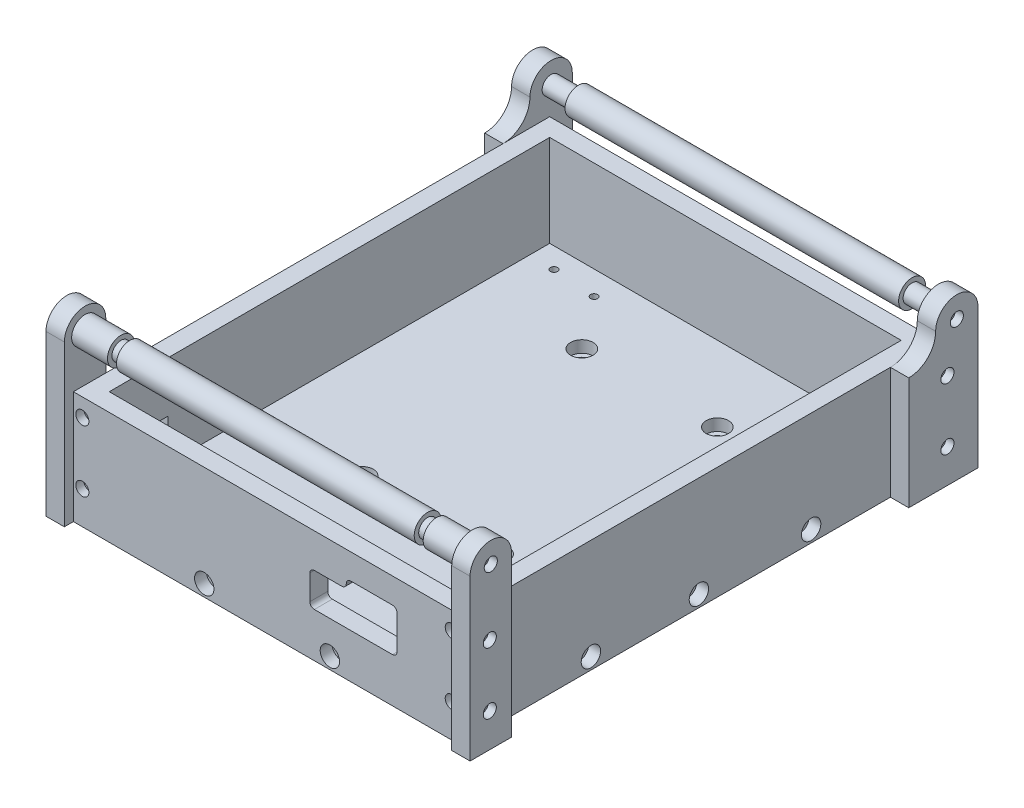
from build123d import *

# Parameters (mm, degrees)
SKETCH1_W                                           = 137.2
SKETCH1_H                                           = 168.7
BOSS_EXTRUDE1_DEPTH                                 = 6.35
BOSS_EXTRUDE2_DEPTH                                 = 32.5
BOSS_EXTRUDE2_DEPTH_BACK                            = 7.35
SKETCH3_W                                           = 137.2
SKETCH3_H                                           = 168.7
SKETCH3_W_2                                         = 124.5
SKETCH3_H_2                                         = 156
CBORE_FOR_0_SOCKET_HEAD_CAP_SCREW1_D                = 2.38125
CBORE_FOR_0_SOCKET_HEAD_CAP_SCREW1_DEPTH            = 10.05
CBORE_FOR_0_SOCKET_HEAD_CAP_SCREW1_CBORE_D          = 4.6482
CBORE_FOR_0_SOCKET_HEAD_CAP_SCREW1_CBORE_DEPTH      = 2.8448
CBORE_FOR_0_SOCKET_HEAD_CAP_SCREW1_TIP              = 0.715399675
CBORE_FOR_0_SOCKET_HEAD_CAP_SCREW2_D                = 3.571875
CBORE_FOR_0_SOCKET_HEAD_CAP_SCREW2_DEPTH            = 10.05
CBORE_FOR_0_SOCKET_HEAD_CAP_SCREW2_CBORE_D          = 6.858
CBORE_FOR_0_SOCKET_HEAD_CAP_SCREW2_CBORE_DEPTH      = 4.1656
CBORE_FOR_0_SOCKET_HEAD_CAP_SCREW2_TIP              = 1.073099512
CBORE_FOR_0_SOCKET_HEAD_CAP_SCREW2_ON_F_D           = 3.571875
CBORE_FOR_0_SOCKET_HEAD_CAP_SCREW2_ON_F_DEPTH       = 10.05
CBORE_FOR_0_SOCKET_HEAD_CAP_SCREW2_ON_F_CBORE_D     = 6.858
CBORE_FOR_0_SOCKET_HEAD_CAP_SCREW2_ON_F_CBORE_DEPTH = 4.1656
CBORE_FOR_0_SOCKET_HEAD_CAP_SCREW2_ON_F_TIP         = 1.073099512
BOSS_EXTRUDE3_DEPTH                                 = 6.497870199
SKETCH11_R                                          = 3.175
BOSS_EXTRUDE4_DEPTH                                 = 150.195740398
SKETCH13_R                                          = 3.175
BOSS_EXTRUDE5_DEPTH                                 = 150.195740398
BOSS_EXTRUDE6_START                                 = -15.85
SKETCH15_R                                          = 4.7625
BOSS_EXTRUDE6_DEPTH                                 = 118.15
CBORE_FOR_0_SOCKET_HEAD_CAP_SCREW3_D                = 2.38125
CBORE_FOR_0_SOCKET_HEAD_CAP_SCREW3_DEPTH            = 10.05
CBORE_FOR_0_SOCKET_HEAD_CAP_SCREW3_CBORE_D          = 4.6482
CBORE_FOR_0_SOCKET_HEAD_CAP_SCREW3_CBORE_DEPTH      = 2.8448
CBORE_FOR_0_SOCKET_HEAD_CAP_SCREW3_TIP              = 0.715399675
CBORE_FOR_8_SOCKET_HEAD_CAP_SCREW1_D                = 4.4958
CBORE_FOR_8_SOCKET_HEAD_CAP_SCREW1_DEPTH            = 10.05
CBORE_FOR_8_SOCKET_HEAD_CAP_SCREW1_CBORE_D          = 7.9375
CBORE_FOR_8_SOCKET_HEAD_CAP_SCREW1_CBORE_DEPTH      = 4.1656
CBORE_FOR_8_SOCKET_HEAD_CAP_SCREW1_TIP              = 1.350674586
CUT_EXTRUDE1_DEPTH                                  = 10
SKETCH24_R                                          = 4.7625
BOSS_EXTRUDE7_DEPTH                                 = 12.7
BOSS_EXTRUDE8_START                                 = 3.175
SKETCH25_R                                          = 4.7625
BOSS_EXTRUDE8_DEPTH                                 = 52.73
SKETCH27_R                                          = 1.25
CUT_EXTRUDE3_DEPTH                                  = 10
SKETCH28_W                                          = 15
SKETCH28_H                                          = 8
CUT_EXTRUDE4_DEPTH                                  = 10


with BuildPart() as part:
    # Sketch1 → Boss-Extrude1 (new body)
    with BuildSketch(Plane(origin=(0, 0, 0), x_dir=(1, 0, 0), z_dir=(0, 1, 0))):
        with Locations((57.25, 73)):
            Rectangle(SKETCH1_W, SKETCH1_H)
    extrude(amount=-BOSS_EXTRUDE1_DEPTH)

    # Sketch3 → Boss-Extrude2 (add, two sides: drawn at the far end of the back side and taken through both)
    with BuildSketch(Plane(origin=(0, 0, 0), x_dir=(1, 0, 0), z_dir=(0, 1, 0)).offset(-BOSS_EXTRUDE2_DEPTH_BACK)):
        with Locations((57.25, 73)):
            Rectangle(SKETCH3_W, SKETCH3_H)
        with Locations((57.25, 73)):
            Rectangle(SKETCH3_W_2, SKETCH3_H_2, mode=Mode.SUBTRACT)
    extrude(amount=BOSS_EXTRUDE2_DEPTH + BOSS_EXTRUDE2_DEPTH_BACK)

    # CBORE for #0 Socket Head Cap Screw1
    with Locations(Plane(origin=(-8.175, 26.15, 11.35), x_dir=(1, 0, 0), z_dir=(0, 0, 1))):
        with Locations((0, 0), (0, -21.825), (130.85, 0), (130.85, -21.825)):
            CounterBoreHole(CBORE_FOR_0_SOCKET_HEAD_CAP_SCREW1_D / 2, CBORE_FOR_0_SOCKET_HEAD_CAP_SCREW1_CBORE_D / 2, CBORE_FOR_0_SOCKET_HEAD_CAP_SCREW1_CBORE_DEPTH, depth=CBORE_FOR_0_SOCKET_HEAD_CAP_SCREW1_DEPTH)
            with Locations((0, 0, -(CBORE_FOR_0_SOCKET_HEAD_CAP_SCREW1_DEPTH + CBORE_FOR_0_SOCKET_HEAD_CAP_SCREW1_TIP / 2))):  # 118° drill point
                Cone(0, CBORE_FOR_0_SOCKET_HEAD_CAP_SCREW1_D / 2, CBORE_FOR_0_SOCKET_HEAD_CAP_SCREW1_TIP, mode=Mode.SUBTRACT)

    # CBORE for #0 Socket Head Cap Screw2
    with Locations(Plane(origin=(125.85, -3.175, -34.75), x_dir=(0, 0, 1), z_dir=(1, 0, 0))):
        with Locations((0, 0), (-38.25, 0), (-78, 0)):
            CounterBoreHole(CBORE_FOR_0_SOCKET_HEAD_CAP_SCREW2_D / 2, CBORE_FOR_0_SOCKET_HEAD_CAP_SCREW2_CBORE_D / 2, CBORE_FOR_0_SOCKET_HEAD_CAP_SCREW2_CBORE_DEPTH, depth=CBORE_FOR_0_SOCKET_HEAD_CAP_SCREW2_DEPTH)
            with Locations((0, 0, -(CBORE_FOR_0_SOCKET_HEAD_CAP_SCREW2_DEPTH + CBORE_FOR_0_SOCKET_HEAD_CAP_SCREW2_TIP / 2))):  # 118° drill point
                Cone(0, CBORE_FOR_0_SOCKET_HEAD_CAP_SCREW2_D / 2, CBORE_FOR_0_SOCKET_HEAD_CAP_SCREW2_TIP, mode=Mode.SUBTRACT)

    # CBORE for #0 Socket Head Cap Screw2 on f
    with Locations(Plane(origin=(35, -3.175, 11.35), x_dir=(1, 0, 0), z_dir=(0, 0, 1))):
        with Locations((0, 0), (44.5, 0)):
            CounterBoreHole(CBORE_FOR_0_SOCKET_HEAD_CAP_SCREW2_ON_F_D / 2, CBORE_FOR_0_SOCKET_HEAD_CAP_SCREW2_ON_F_CBORE_D / 2, CBORE_FOR_0_SOCKET_HEAD_CAP_SCREW2_ON_F_CBORE_DEPTH, depth=CBORE_FOR_0_SOCKET_HEAD_CAP_SCREW2_ON_F_DEPTH)
            with Locations((0, 0, -(CBORE_FOR_0_SOCKET_HEAD_CAP_SCREW2_ON_F_DEPTH + CBORE_FOR_0_SOCKET_HEAD_CAP_SCREW2_ON_F_TIP / 2))):  # 118° drill point
                Cone(0, CBORE_FOR_0_SOCKET_HEAD_CAP_SCREW2_ON_F_D / 2, CBORE_FOR_0_SOCKET_HEAD_CAP_SCREW2_ON_F_TIP, mode=Mode.SUBTRACT)

    # Sketch9 → Boss-Extrude3 (add)
    with BuildSketch(Plane(origin=(125.85, 0, 0), x_dir=(0, 0, -1), z_dir=(1, 0, 0))):
        with BuildLine():
            Line((-14.545993048, -7.35), (0.133202369, -7.35))
            Line((0.133202369, -7.35), (0.133202369, 49.35))
            ThreePointArc((0.133202369, 49.35), (-7.206395339, 56.689597709), (-14.545993048, 49.35))
            Line((-14.545993048, 49.35), (-14.545993048, -7.35))
        make_face()
        with BuildLine():
            Line((140.825, -7.35), (157.35, -7.35))
            Line((157.35, -7.35), (165.35, -7.35))
            Line((165.35, -7.35), (165.35, 42.025))
            ThreePointArc((165.35, 42.025), (157.85, 49.525), (150.35, 42.025))
            ThreePointArc((150.35, 42.025), (147.560192091, 35.289807909), (140.825, 32.5))
            Line((140.825, 32.5), (140.825, -7.35))
        make_face()
    boss_extrude3 = extrude(amount=BOSS_EXTRUDE3_DEPTH)

    # Mirror1: Boss-Extrude3 across plane
    add(boss_extrude3.mirror(Plane(origin=(57.25, 0, 0), x_dir=(0, 0, 1), z_dir=(1, 0, 0))))

    # Sketch11 → Boss-Extrude4 (add)
    with BuildSketch(Plane.ZY.offset(17.847870199)):
        with Locations((7.206395339, 49.35)):
            Circle(SKETCH11_R)
    extrude(amount=-BOSS_EXTRUDE4_DEPTH)

    # Sketch13 → Boss-Extrude5 (add)
    with BuildSketch(Plane(origin=(132.347870199, 0, 0), x_dir=(0, 0, -1), z_dir=(1, 0, 0))):
        with Locations((157.85, 42.025)):
            Circle(SKETCH13_R)
    extrude(amount=-BOSS_EXTRUDE5_DEPTH)

    # Sketch15 → Boss-Extrude6 (add)
    with BuildSketch(Plane(origin=(132.347870199, 0, 0), x_dir=(0, 0, -1), z_dir=(1, 0, 0)).offset(BOSS_EXTRUDE6_START)):
        with Locations((157.85, 42.025)):
            Circle(SKETCH15_R)
    extrude(amount=-BOSS_EXTRUDE6_DEPTH)

    # CBORE for #0 Socket Head Cap Screw3
    with Locations(Plane(origin=(132.347870199, 49.35, 7.206395339), x_dir=(0, 0, 1), z_dir=(1, 0, 0))):
        with Locations((0, 0), (-165.056395339, 7.325), (0.350160812, 23.034267856), (0.350160812, 44.806334912), (-161.73125819, 23.034267856), (-161.73125819, 44.806334912)):
            CounterBoreHole(CBORE_FOR_0_SOCKET_HEAD_CAP_SCREW3_D / 2, CBORE_FOR_0_SOCKET_HEAD_CAP_SCREW3_CBORE_D / 2, CBORE_FOR_0_SOCKET_HEAD_CAP_SCREW3_CBORE_DEPTH, depth=CBORE_FOR_0_SOCKET_HEAD_CAP_SCREW3_DEPTH)
            with Locations((0, 0, -(CBORE_FOR_0_SOCKET_HEAD_CAP_SCREW3_DEPTH + CBORE_FOR_0_SOCKET_HEAD_CAP_SCREW3_TIP / 2))):  # 118° drill point
                Cone(0, CBORE_FOR_0_SOCKET_HEAD_CAP_SCREW3_D / 2, CBORE_FOR_0_SOCKET_HEAD_CAP_SCREW3_TIP, mode=Mode.SUBTRACT)

    # CBORE for #8 Socket Head Cap Screw1
    with Locations(Plane(origin=(0, 0, 0), x_dir=(1, 0, 0), z_dir=(0, 1, 0))):
        with Locations((33.042732815, 124.34112088), (81.032892264, 124.34112088), (81.032892264, 46.526568554), (33.042732815, 46.526568554)):
            CounterBoreHole(CBORE_FOR_8_SOCKET_HEAD_CAP_SCREW1_D / 2, CBORE_FOR_8_SOCKET_HEAD_CAP_SCREW1_CBORE_D / 2, CBORE_FOR_8_SOCKET_HEAD_CAP_SCREW1_CBORE_DEPTH, depth=CBORE_FOR_8_SOCKET_HEAD_CAP_SCREW1_DEPTH)
            with Locations((0, 0, -(CBORE_FOR_8_SOCKET_HEAD_CAP_SCREW1_DEPTH + CBORE_FOR_8_SOCKET_HEAD_CAP_SCREW1_TIP / 2))):  # 118° drill point
                Cone(0, CBORE_FOR_8_SOCKET_HEAD_CAP_SCREW1_D / 2, CBORE_FOR_8_SOCKET_HEAD_CAP_SCREW1_TIP, mode=Mode.SUBTRACT)

    # Sketch22 → Cut-Extrude1 (cut)
    with BuildSketch(Plane.XY.offset(11.35)):
        with BuildLine():
            Line((82.911998474, 20.365534125), (73.990388306, 20.365534125))
            ThreePointArc((73.990388306, 20.365534125), (72.867856291, 19.90056614), (72.402888306, 18.778034125))
            Line((72.402888306, 18.778034125), (72.402888306, 9.967602133))
            ThreePointArc((72.402888306, 9.967602133), (72.867856291, 8.845070118), (73.990388306, 8.380102133))
            Line((73.990388306, 8.380102133), (101.667987328, 8.380102133))
            ThreePointArc((101.667987328, 8.380102133), (102.790519344, 8.845070118), (103.255487328, 9.967602133))
            Line((103.255487328, 9.967602133), (103.255487328, 21.9696823))
            ThreePointArc((103.255487328, 21.9696823), (102.790519344, 23.092214315), (101.667987328, 23.5571823))
            Line((101.667987328, 23.5571823), (86.889966346, 23.5571823))
            ThreePointArc((86.889966346, 23.5571823), (85.76743433, 23.092214315), (85.302466346, 21.9696823))
            Line((85.302466346, 21.9696823), (85.302466346, 21.953034125))
            ThreePointArc((85.302466346, 21.953034125), (84.837498361, 20.83050211), (83.714966346, 20.365534125))
            Line((83.714966346, 20.365534125), (82.911998474, 20.365534125))
        make_face()
    extrude(amount=-CUT_EXTRUDE1_DEPTH, mode=Mode.SUBTRACT)

    # Sketch24 → Boss-Extrude7 (add)
    with BuildSketch(Plane(origin=(-11.35, 0, 0), x_dir=(0, 0, -1), z_dir=(1, 0, 0))):
        with Locations((-7.206395339, 49.35)):
            Circle(SKETCH24_R)
    boss_extrude7 = extrude(amount=BOSS_EXTRUDE7_DEPTH)

    # Sketch25 → Boss-Extrude8 (add)
    with BuildSketch(Plane(origin=(1.35, 0, 0), x_dir=(0, 0, -1), z_dir=(1, 0, 0)).offset(BOSS_EXTRUDE8_START)):
        with Locations((-7.206395339, 49.35)):
            Circle(SKETCH25_R)
    boss_extrude8 = extrude(amount=BOSS_EXTRUDE8_DEPTH)

    # Mirror2: Boss-Extrude7, Boss-Extrude8 across plane
    add(boss_extrude7.mirror(Plane(origin=(57.255, 49.35, 7.206395339), x_dir=(0, 0, 1), z_dir=(1, 0, 0))))
    add(boss_extrude8.mirror(Plane(origin=(57.255, 49.35, 7.206395339), x_dir=(0, 0, 1), z_dir=(1, 0, 0))))

    # Sketch27 → Cut-Extrude3 (cut)
    with BuildSketch(Plane(origin=(0, 0, 0), x_dir=(1, 0, 0), z_dir=(0, 1, 0))):
        with Locations(Location((3.785, 143.74, 0), (0, 0, 270))):
            Circle(SKETCH27_R)
        with Locations(Location((19.176, 142.55, 0), (0, 0, 270))):
            Circle(SKETCH27_R)
        with Locations(Location((95.175, 142.55, 0), (0, 0, 270))):
            Circle(SKETCH27_R)
        with Locations(Location((110.719, 143.74, 0), (0, 0, 270))):
            Circle(SKETCH27_R)
        with Locations(Location((19.176, 24.55, 0), (0, 0, 270))):
            Circle(SKETCH27_R)
        with Locations(Location((95.175, 24.55, 0), (0, 0, 270))):
            Circle(SKETCH27_R)
        with Locations(Location((110.719, 2.262, 0), (0, 0, 270))):
            Circle(SKETCH27_R)
    extrude(amount=-CUT_EXTRUDE3_DEPTH, mode=Mode.SUBTRACT)

    # Sketch28 → Cut-Extrude4 (cut)
    with BuildSketch(Plane.ZY.offset(11.35)):
        with Locations((-8.35, 10.6)):
            Rectangle(SKETCH28_W, SKETCH28_H)
    extrude(amount=-CUT_EXTRUDE4_DEPTH, mode=Mode.SUBTRACT)


solid = part.part
